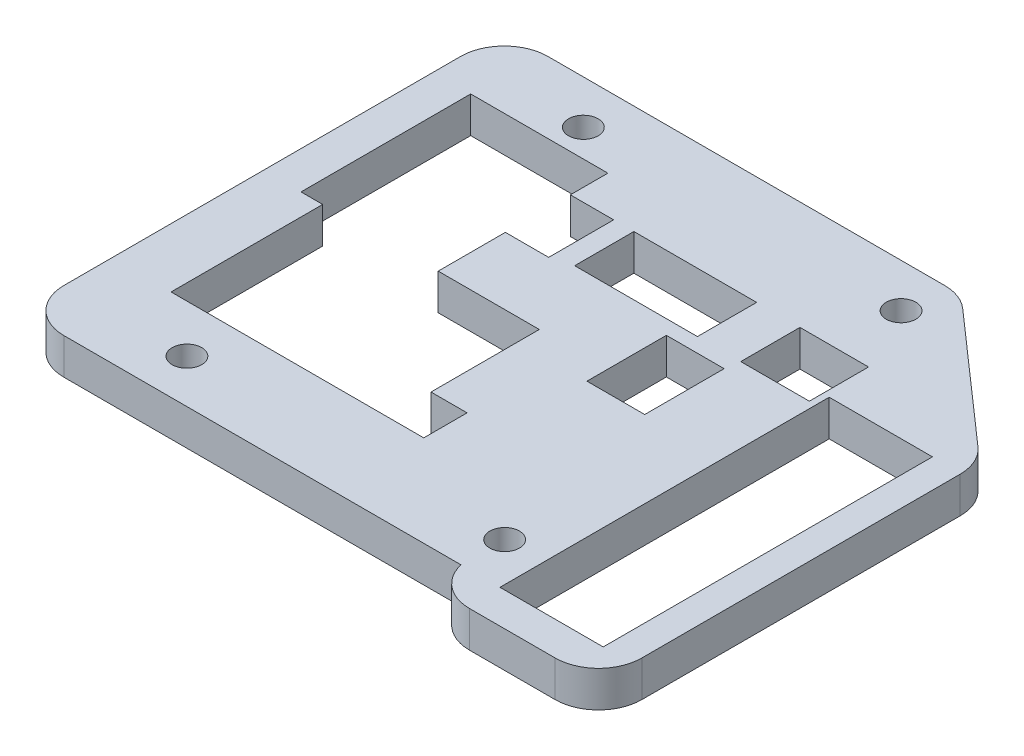
from build123d import *

# Parameters (mm, degrees)
SKETCH_2_R          = 6.05
SKETCH_2_R_2        = 2.05
EXTRUDE_1_DEPTH     = 5
EXTRUDE_1_2_DEPTH   = 5
EXTRUDE_1_3_DEPTH   = 5
EXTRUDE_1_4_DEPTH   = 5
SKETCH_6_R          = 2.05
EXTRUDE_1_5_DEPTH   = 5
SKETCH_7_W          = 14.3
SKETCH_7_H          = 45.6
SKETCH_7_W_2        = 9.5
SKETCH_7_H_2        = 8.2
SKETCH_7_W_3        = 8
SKETCH_7_H_3        = 11
SKETCH_7_W_4        = 17
CUT_EXTRUDE_1_DEPTH = 5


with BuildPart() as part:
    # 草图2 → Extrude 1 (new body)
    with BuildSketch(Plane(origin=(0, 0, 0), x_dir=(-1, 0, 0), z_dir=(0, -1, 0))):
        with Locations((-103.2, -9.35)):
            Circle(SKETCH_2_R)
        with Locations((-103.2, -9.35)):
            Circle(SKETCH_2_R_2, mode=Mode.SUBTRACT)
    extrude(amount=EXTRUDE_1_DEPTH)



with BuildPart() as body_2:
    # 草图2 → Extrude 1 2 (new body)
    with BuildSketch(Plane(origin=(0, 0, 0), x_dir=(-1, 0, 0), z_dir=(0, -1, 0))):
        with Locations((-59.2, -9.35)):
            Circle(SKETCH_2_R)
        with Locations((-59.2, -9.35)):
            Circle(SKETCH_2_R_2, mode=Mode.SUBTRACT)
    extrude(amount=EXTRUDE_1_2_DEPTH)


with BuildPart() as body_3:
    # 草图2 → Extrude 1 3 (new body)
    with BuildSketch(Plane(origin=(0, 0, 0), x_dir=(-1, 0, 0), z_dir=(0, -1, 0))):
        with Locations((-59.2, -64.25)):
            Circle(SKETCH_2_R)
        with Locations((-59.2, -64.25)):
            Circle(SKETCH_2_R_2, mode=Mode.SUBTRACT)
    extrude(amount=EXTRUDE_1_3_DEPTH)


with BuildPart() as body_4:
    # 草图2 → Extrude 1 4 (new body)
    with BuildSketch(Plane(origin=(0, 0, 0), x_dir=(-1, 0, 0), z_dir=(0, -1, 0))):
        with Locations((-103.2, -64.25)):
            Circle(SKETCH_2_R)
        with Locations((-103.2, -64.25)):
            Circle(SKETCH_2_R_2, mode=Mode.SUBTRACT)
    extrude(amount=EXTRUDE_1_4_DEPTH)


with BuildPart() as part_1:
    add(part.part)

    add(body_2.part)  # Extrude 1 5 merges body 2

    add(body_3.part)  # Extrude 1 5 merges body 3

    add(body_4.part)  # Extrude 1 5 merges body 4
    # 草图6 → Extrude 1 5 (add)
    with BuildSketch(Plane(origin=(0, 0, 0), x_dir=(1, 0, 0), z_dir=(0, 1, 0))):
        with BuildLine():
            Line((107.197188412, -4.808526143), (124.864153797, -20.358145394))
            ThreePointArc((124.864153797, -20.358145394), (126.367399875, -22.390742927), (126.9, -24.862086409))
            Line((126.9, -24.862086409), (126.9, -68.95))
            ThreePointArc((126.9, -68.95), (125.142640687, -73.192640687), (120.9, -74.95))
            Line((120.9, -74.95), (109.046152581, -74.95))
            ThreePointArc((109.046152581, -74.95), (105.311182702, -73.645742753), (103.2, -70.3))
            Line((103.2, -70.3), (48.2, -70.3))
            ThreePointArc((48.2, -70.3), (43.957359313, -68.542640687), (42.2, -64.3))
            Line((42.2, -64.3), (42.2, -9.35))
            ThreePointArc((42.2, -9.35), (43.972003974, -5.072003974), (48.25, -3.3))
            Line((48.25, -3.3), (59.2, -3.3))
            Line((59.2, -3.3), (103.2, -3.3))
            ThreePointArc((103.2, -3.3), (105.336186224, -3.689681244), (107.197188412, -4.808526143))
        make_face()
        with Locations(Location((103.2, -9.35, 0), (0, 0, 270))):
            Circle(SKETCH_6_R, mode=Mode.SUBTRACT)
        with Locations(Location((103.2, -64.25, 0), (0, 0, 270))):
            Circle(SKETCH_6_R, mode=Mode.SUBTRACT)
        with Locations(Location((59.2, -64.25, 0), (0, 0, 270))):
            Circle(SKETCH_6_R, mode=Mode.SUBTRACT)
        with Locations(Location((59.2, -9.35, 0), (0, 0, 90))):
            Circle(SKETCH_6_R, mode=Mode.SUBTRACT)
    extrude(amount=-EXTRUDE_1_5_DEPTH)

    # 草图7 → 切除-拉伸1 (cut)
    with BuildSketch(Plane(origin=(0, -5, 3), x_dir=(1, 0, 0), z_dir=(0, -1, 0))):
        with Locations((115.75, 44.5)):
            Rectangle(SKETCH_7_W, SKETCH_7_H)
        with Locations((102.95, 19.45)):
            Rectangle(SKETCH_7_W_2, SKETCH_7_H_2)
        with Locations((93.9, 31.05)):
            Rectangle(SKETCH_7_W_3, SKETCH_7_H_3)
        with Locations((83.7, 19.45)):
            Rectangle(SKETCH_7_W_4, SKETCH_7_H_2)
        Polygon((72.4, 24.35), (72.4, 15.35), (66.4, 15.35), (66.4, 10.15), (47.4, 10.15), (47.4, 33.65), (50.4, 33.65), (50.4, 54.65), (85.4, 54.65), (85.4, 48.65), (80.4, 48.65), (80.4, 33.65), (66.4, 33.65), (66.4, 24.35), align=None)
    extrude(amount=-CUT_EXTRUDE_1_DEPTH, mode=Mode.SUBTRACT)


solid = part_1.part
